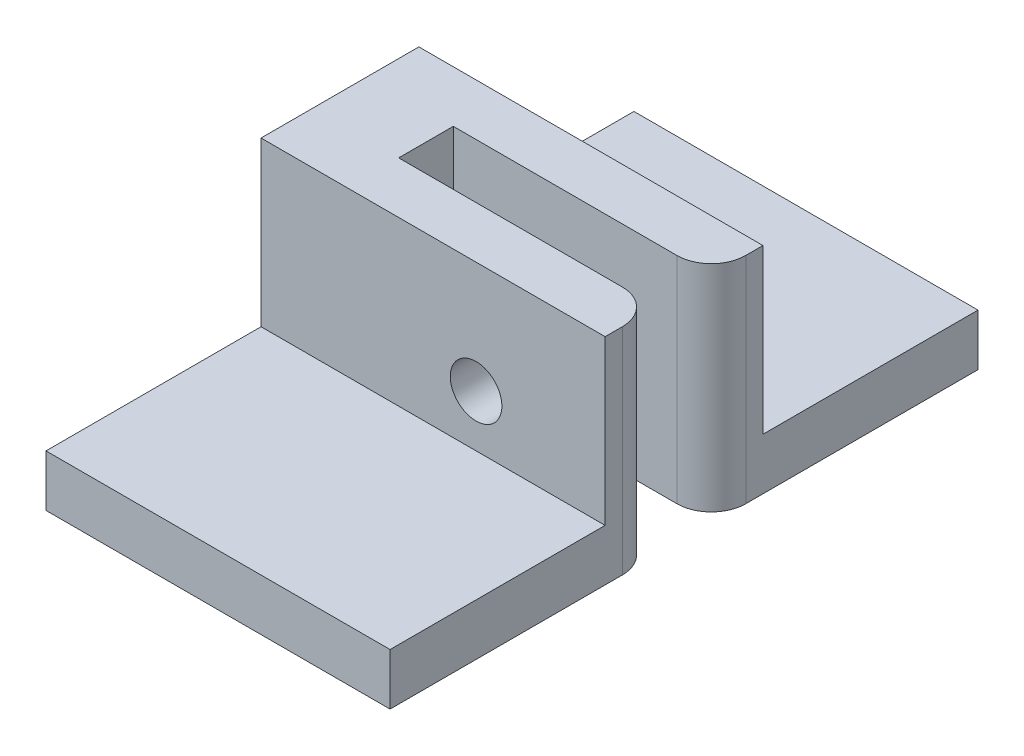
from build123d import *

# Parameters (mm, degrees)
BOSS_EXTRUDE1_DEPTH = 20
SKETCH2_W           = 3.175
SKETCH2_H           = 12.5
CUT_EXTRUDE1_DEPTH  = 15
SKETCH3_R           = 1.5
CUT_EXTRUDE2_DEPTH  = 33.032103037
FILLET1_R           = 2


with BuildPart() as part:
    # Sketch1 → Boss-Extrude1 (new body)
    with BuildSketch(Plane(origin=(0, 0, 0), x_dir=(0, 0, -1), z_dir=(1, 0, 0))):
        Polygon((0, 12.5), (3, 12.5), (3, 3), (15.5, 3), (15.5, 0), (0, 0), (-3.175, 0), (-18.675, 0), (-18.675, 3), (-6.175, 3), (-6.175, 12.5), (-3.175, 12.5), align=None)
    extrude(amount=BOSS_EXTRUDE1_DEPTH)

    # Sketch2 → Cut-Extrude1 (cut)
    with BuildSketch(Plane(origin=(20, 0, 0), x_dir=(0, 0, -1), z_dir=(1, 0, 0))):
        with Locations((-1.5875, 6.25)):
            Rectangle(SKETCH2_W, SKETCH2_H)
    extrude(amount=-CUT_EXTRUDE1_DEPTH, mode=Mode.SUBTRACT)

    # Sketch3 → Cut-Extrude2 (cut, through all)
    with BuildSketch(Plane.XY.offset(6.175)):
        with Locations((12.5, 6)):
            Circle(SKETCH3_R)
    extrude(amount=-CUT_EXTRUDE2_DEPTH, mode=Mode.SUBTRACT)

    # Fillet1
    fillet1_edges = [part.edges().sort_by_distance(p)[0] for p in [
        (20, 6.25, 0),
        (20, 6.25, 3.175),
    ]]
    fillet(fillet1_edges, radius=FILLET1_R)


solid = part.part
